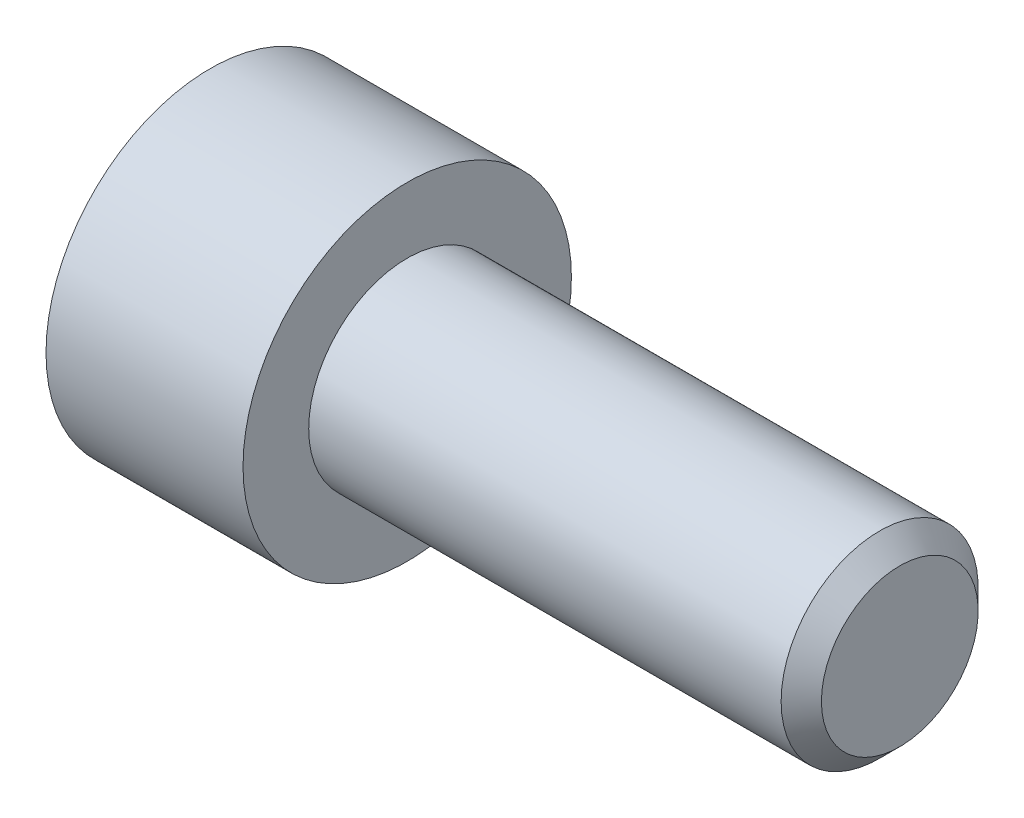
from build123d import *

# Parameters (mm, degrees)
CUT_EXTRUDE_1_DEPTH = 3


with BuildPart() as part:
    # 草图1 → 旋转1 (revolve)
    with BuildSketch(Plane.XY):
        Polygon((-6, 0), (-6, 5), (0, 5), (0, 3), (14.3865, 3), (15, 2.3865), (15, 0), align=None)
    revolve(axis=Axis((15, 0, 0), (-1, 0, 0)))

    # 草图2 → 切除-旋转1 (revolve, cut)
    with BuildSketch(Plane.XY):
        Polygon((-6, 0), (-6, 2.5), (-3, 2.5), (-2.330127019, 0), align=None)
    revolve(axis=Axis((-2.330127019, 0, 0), (-1, 0, 0)), mode=Mode.SUBTRACT)

    # 草图3 → 切除-拉伸1 (cut)
    with BuildSketch(Plane(origin=(-6, 0, 0), x_dir=(0, 0, -1), z_dir=(1, 0, 0))):
        Polygon((-2.5, 1.443375673), (-2.5, -1.443375673), (0, -2.886751346), (2.5, -1.443375673), (2.5, 1.443375673), (0, 2.886751346), align=None)
    extrude(amount=CUT_EXTRUDE_1_DEPTH, mode=Mode.SUBTRACT)


solid = part.part
